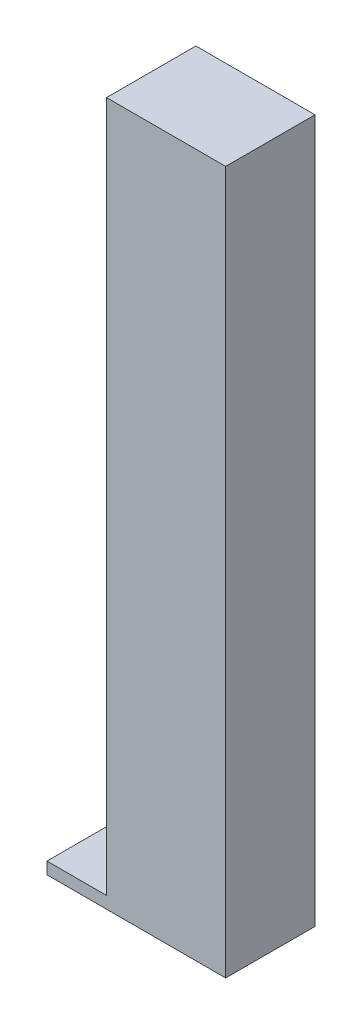
from build123d import *

# Parameters (mm, degrees)
BOSS_EXTRUDE1_DEPTH = 115
SKETCH3_W           = 20
SKETCH3_H           = 15
BOSS_EXTRUDE2_DEPTH = 1
SKETCH7_W           = 30
SKETCH7_H           = 15
BOSS_EXTRUDE5_DEPTH = 2


with BuildPart() as part:
    # Sketch2 → Boss-Extrude1 (new body)
    with BuildSketch(Plane(origin=(0, 0, 0), x_dir=(1, 0, 0), z_dir=(0, 1, 0))):
        Polygon((-10, 4.926686322), (-10, 0.926686322), (-7, 0.926686322), (-7, 2.926686322), (0, 2.926686322), (0, 3.926686322), (1, 3.926686322), (1, 2.926686322), (8, 2.926686322), (8, -8.073313678), (1, -8.073313678), (1, -9.073313678), (0, -9.073313678), (0, -8.073313678), (-7, -8.073313678), (-7, -6.073313678), (-10, -6.073313678), (-10, -10.073313678), (10, -10.073313678), (10, 4.926686322), align=None)
    extrude(amount=BOSS_EXTRUDE1_DEPTH)

    # Sketch3 → Boss-Extrude2 (add)
    with BuildSketch(Plane(origin=(0, 115, 0), x_dir=(1, 0, 0), z_dir=(0, 1, 0))):
        with Locations((0, -2.573313678)):
            Rectangle(SKETCH3_W, SKETCH3_H)
    extrude(amount=BOSS_EXTRUDE2_DEPTH)

    # Sketch7 → Boss-Extrude5 (add)
    with BuildSketch(Plane(origin=(0, 0, 0), x_dir=(-1, 0, 0), z_dir=(0, -1, 0))):
        with Locations((5, -2.573313678)):
            Rectangle(SKETCH7_W, SKETCH7_H)
    extrude(amount=BOSS_EXTRUDE5_DEPTH)


solid = part.part
